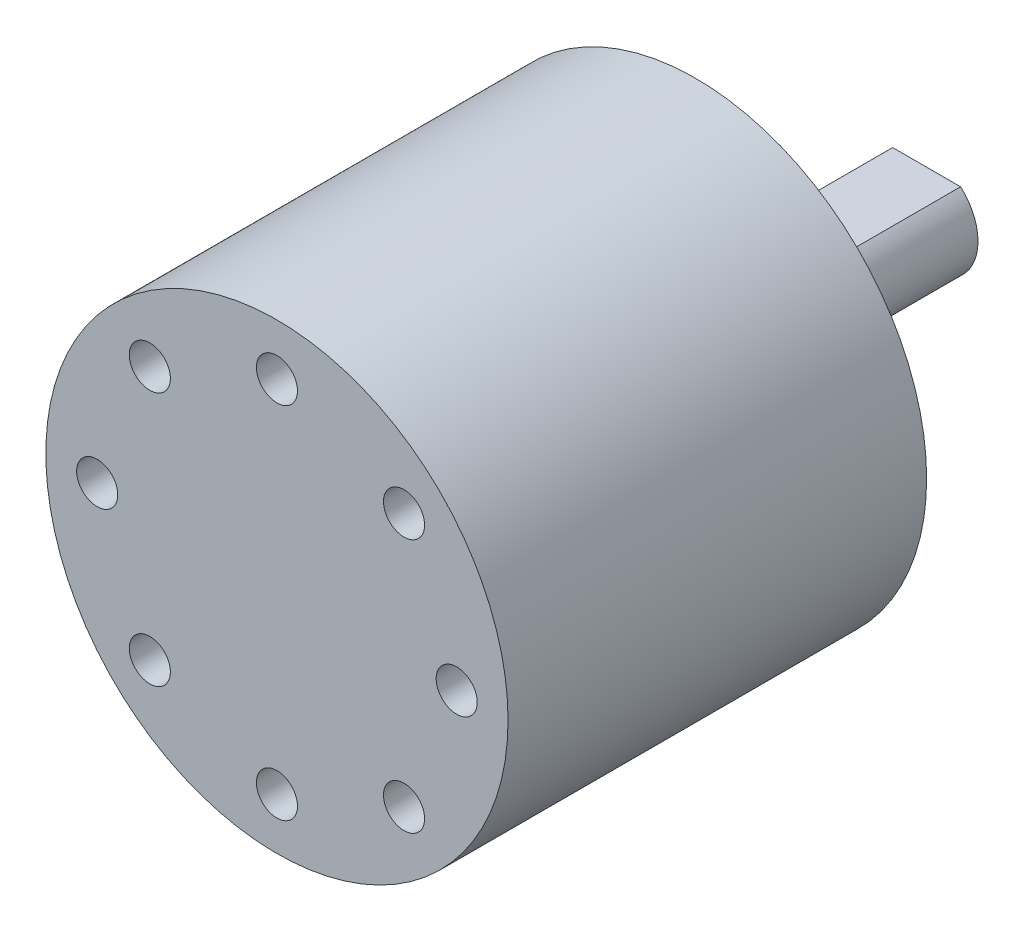
from build123d import *

# Parameters (mm, degrees)
SKETCH1_R           = 18
BOSS_EXTRUDE1_DEPTH = 32.6
SKETCH2_R           = 1.6
CUT_EXTRUDE1_DEPTH  = 42.361334601
CIRPATTERN1_COUNT   = 8
SKETCH3_R           = 11
BOSS_EXTRUDE2_DEPTH = 2
SKETCH4_R           = 4
BOSS_EXTRUDE3_DEPTH = 16
CUT_EXTRUDE2_START  = -15
CUT_EXTRUDE2_DEPTH  = 15


with BuildPart() as part:
    # Sketch1 → Boss-Extrude1 (new body)
    with BuildSketch(Plane.XY):
        Circle(SKETCH1_R)
    extrude(amount=BOSS_EXTRUDE1_DEPTH)

    # Sketch2 → Cut-Extrude1 (cut, through all)
    with BuildSketch(Plane(origin=(0, 0, 0), x_dir=(-1, 0, 0), z_dir=(0, 0, -1))):
        with Locations((0, 14)):
            Circle(SKETCH2_R)
    cut_extrude1 = extrude(amount=-CUT_EXTRUDE1_DEPTH, mode=Mode.SUBTRACT)

    # CirPattern1: Cut-Extrude1 ×8 about axis
    cirpattern1_axis = Axis((0, 0, 0), (0, 0, 1))
    for i in range(1, CIRPATTERN1_COUNT):
        add(cut_extrude1.rotate(cirpattern1_axis, i * 360 / CIRPATTERN1_COUNT), mode=Mode.SUBTRACT)

    # Sketch3 → Boss-Extrude2 (add)
    with BuildSketch(Plane(origin=(0, 0, 0), x_dir=(-1, 0, 0), z_dir=(0, 0, -1))):
        with Locations(Location((0, 0, 0), (0, 0, 180))):
            Circle(SKETCH3_R)
    extrude(amount=BOSS_EXTRUDE2_DEPTH)

    # Sketch4 → Boss-Extrude3 (add)
    with BuildSketch(Plane(origin=(0, 0, -2), x_dir=(-1, 0, 0), z_dir=(0, 0, -1))):
        Circle(SKETCH4_R)
    extrude(amount=BOSS_EXTRUDE3_DEPTH)

    # Sketch5 → Cut-Extrude2 (cut)
    with BuildSketch(Plane(origin=(0, 0, -18), x_dir=(-1, 0, 0), z_dir=(0, 0, -1)).offset(CUT_EXTRUDE2_START)):
        with BuildLine():
            Line((-2.645751311, 3), (2.645751311, 3))
            ThreePointArc((2.645751311, 3), (0, 4), (-2.645751311, 3))
        make_face()
        with BuildLine():
            Line((-2.645751311, -3), (2.645751311, -3))
            ThreePointArc((2.645751311, -3), (0, -4), (-2.645751311, -3))
        make_face()
    extrude(amount=CUT_EXTRUDE2_DEPTH, mode=Mode.SUBTRACT)


solid = part.part
